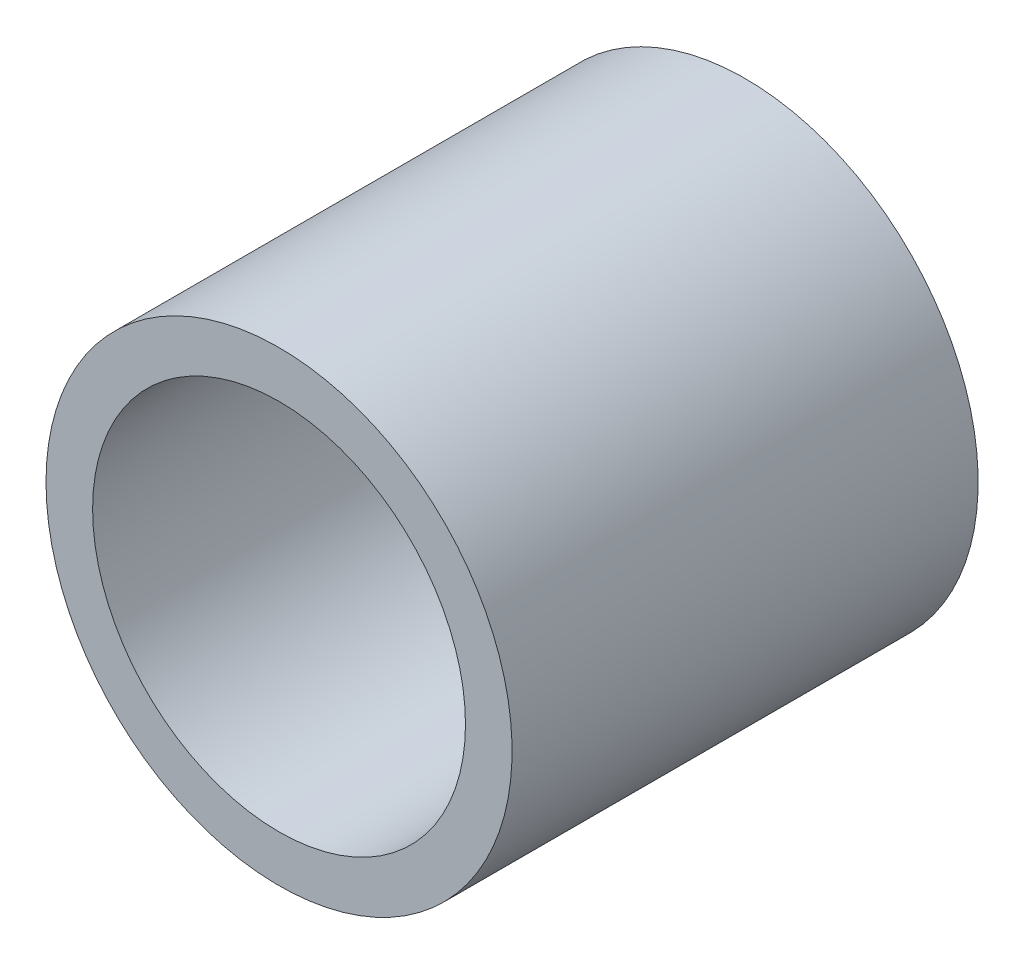
from build123d import *

# Parameters (mm, degrees)
IZIM1_R                     = 10
IZIM1_R_2                   = 8
Y_KSEKLIK_EKSTR_ZYON1_DEPTH = 20


with BuildPart() as part:
    # Çizim1 → Yükseklik-Ekstrüzyon1 (new body)
    with BuildSketch(Plane.XY):
        with Locations(Location((-10.438351937, 10.104610699, 0), (0, 0, 180))):
            Circle(IZIM1_R)
        with Locations(Location((-10.438351937, 10.104610699, 0), (0, 0, 180))):
            Circle(IZIM1_R_2, mode=Mode.SUBTRACT)
    extrude(amount=Y_KSEKLIK_EKSTR_ZYON1_DEPTH)


solid = part.part
